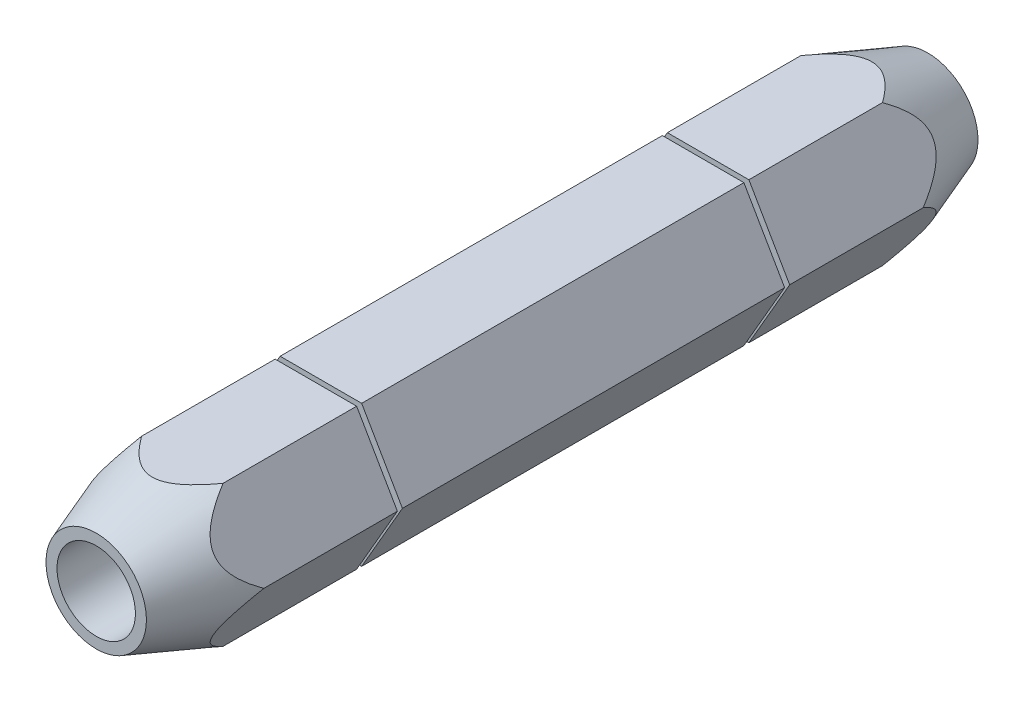
from build123d import *

# Parameters (mm, degrees)
BASE_EXTRUDE_DEPTH = 42.06875
SKETCH3_R          = 3.96875
CUT_EXTRUDE1_DEPTH = 85.842184608


with BuildPart() as part:
    # Sketch1 → Base-Extrude (new, symmetric)
    with BuildSketch(Plane.XY):
        Polygon((8.248891971, 0), (4.124445986, 7.14375), (-4.124445986, 7.14375), (-8.248891971, 0), (-4.124445986, -7.14375), (4.124445986, -7.14375), align=None)
    extrude(amount=BASE_EXTRUDE_DEPTH, both=True)

    # Sketch2 → Cut-Revolve1 (revolve, cut)
    with BuildSketch(Plane(origin=(0, 0, 0), x_dir=(0, 0, -1), z_dir=(1, 0, 0)), mode=Mode.PRIVATE) as cut_revolve1_sk:
        Polygon((19.84375, 6.35), (19.33575, 6.35), (19.33575, 8.89), (-19.33575, 8.89), (-19.33575, 6.35), (-19.84375, 6.35), (-19.84375, 8.89), (-31.600861032, 8.89), (-42.06875, 5.08), (-42.06875, 18.081978304), (42.06875, 18.081978304), (42.06875, 5.08), (31.600861032, 8.89), (19.84375, 8.89), align=None)
    revolve(cut_revolve1_sk.sketch.rotate(Axis((0, 0, 64.541972625), (0, 0, -1)), 90), axis=Axis((0, 0, 64.541972625), (0, 0, -1)), mode=Mode.SUBTRACT)

    # Sketch3 → Cut-Extrude1 (cut, through all)
    with BuildSketch(Plane.XY.offset(42.06875)):
        Circle(SKETCH3_R)
    extrude(amount=-CUT_EXTRUDE1_DEPTH, mode=Mode.SUBTRACT)


solid = part.part
